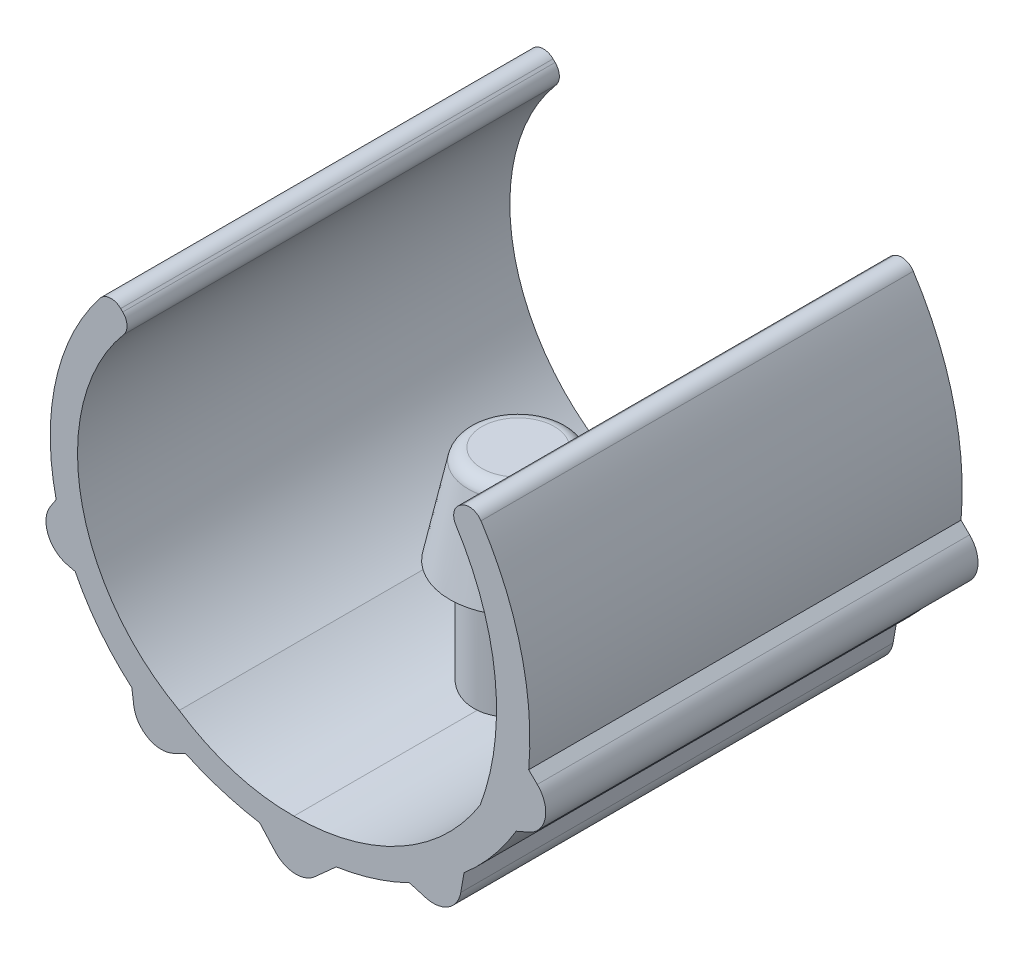
from build123d import *

# Parameters (mm, degrees)
BOSS_EXTRUDE2_DEPTH      = 438
SCALE2_SCALE             = 0.0354
FILLET1_R                = 1
FILLET3_R                = 0.5
BOSS_EXTRUDE4_REACH      = 229.494
BOSS_EXTRUDE4_END_RADIUS = 7.833804904
BOSS_EXTRUDE5_REACH      = 229.494
BOSS_EXTRUDE5_END_RADIUS = 7.195916772
SKETCH9_R                = 2.45
BOSS_EXTRUDE6_DEPTH      = 3.5
BOSS_EXTRUDE6_TAPER      = 12
FILLET4_R                = 0.5


with BuildPart() as part:
    # Sketch1 → Boss-Extrude2 (new body)
    with BuildSketch(Plane.XY):
        with BuildLine():
            Line((-163.578194132, 204.291420663), (-186.376739015, 226.341062883))
            ThreePointArc((-186.376739015, 226.341062883), (-239.375206738, 127.519864833), (-240.870528276, 15.393905402))
            Line((-240.870528276, 15.393905402), (-268.785604462, -26.370002184))
            Line((-268.785604462, -26.370002184), (-221.583341967, -38.017313709))
            ThreePointArc((-221.583341967, -38.017313709), (-196.547148618, -77.434601057), (-164.251041881, -111.161370973))
            Line((-164.251041881, -111.161370973), (-156.910200465, -164.920829998))
            Line((-156.910200465, -164.920829998), (-109.836943046, -141.764303292))
            ThreePointArc((-109.836943046, -141.764303292), (-73.054639313, -155.90344513), (-34.693982777, -164.920829998))
            Line((-34.693982777, -164.920829998), (0, -203.328769621))
            Line((0, -203.328769621), (42.8865283, -164.920829998))
            ThreePointArc((42.8865283, -164.920829998), (80.850316946, -156.155814803), (117.057486625, -141.764303292))
            Line((117.057486625, -141.764303292), (163.626630073, -155.521102036))
            Line((163.626630073, -155.521102036), (172.334894528, -105.315261233))
            ThreePointArc((172.334894528, -105.315261233), (201.269995869, -76.001800701), (225.162074479, -42.450531906))
            Line((225.162074479, -42.450531906), (276.709162079, -20.095520822))
            Line((276.709162079, -20.095520822), (237.860130884, 17.793666683))
            ThreePointArc((237.860130884, 17.793666683), (228.121311005, 125.922470041), (181.39622554, 223.91965937))
            Line((181.39622554, 223.91965937), (156.421805868, 206.970503899))
            ThreePointArc((156.421805868, 206.970503899), (202.986661671, 88.666279899), (188.748912803, -37.672398736))
            ThreePointArc((188.748912803, -37.672398736), (107.904666904, -114.25255983), (0, -141.764303292))
            ThreePointArc((0, -141.764303292), (-60.71851518, -133.27976481), (-116.145688788, -107.077591147))
            ThreePointArc((-116.145688788, -107.077591147), (-216.983443781, 36.858584217), (-163.578194132, 204.291420663))
        make_face()
    extrude(amount=BOSS_EXTRUDE2_DEPTH)


with BuildPart() as part_1:
    # Scale2: scaled about (7.22089485, -18.85403102, 219)
    add(part.part.scale(SCALE2_SCALE).moved(Location((6.965275172, -18.186598322, 211.2474))))

    # Fillet1
    fillet1_edges = [part_1.edges().sort_by_distance(p)[0] for p in [
        (16.76077951, -18.897979759, 219),
        (12.757657877, -23.692045334, 219),
        (6.965275172, -25.384436766, 219),
        (1.410654076, -24.024795704, 219),
        (-2.549735226, -19.120096399, 219),
    ]]
    fillet(fillet1_edges, radius=FILLET1_R)

    # Fillet3
    fillet3_edges = [part_1.edges().sort_by_distance(p)[0] for p in [
        (12.5026071, -10.859842484, 219),
        (13.386701556, -10.25984238, 219),
        (0.367538611, -10.174124696, 219),
        (1.1746071, -10.95468203, 219),
    ]]
    fillet(fillet3_edges, radius=FILLET3_R)

    # Boss-Extrude4: up to this cylinder (the profile starts inside it)
    boss_extrude4_end = Plane(origin=(7.002032477, -15.371335991, 218.5826), z_dir=(0, 0, -1)) * Cylinder(BOSS_EXTRUDE4_END_RADIUS, 475.655609807, mode=Mode.PRIVATE)
    # Sketch5 → Boss-Extrude4 (add, up to the surface)
    with BuildSketch(Plane(origin=(0, -19.405054659, 0), x_dir=(-1, 0, 0), z_dir=(0, -1, 0)), mode=Mode.PRIVATE) as boss_extrude4_sk1:
        with BuildLine():
            Line((-6.838033993, -220.1826), (-6.838033993, -216.9826))
            ThreePointArc((-6.838033993, -216.9826), (-8.438033993, -218.5826), (-6.838033993, -220.1826))
        make_face()
    boss_extrude4_tool1 = extrude(boss_extrude4_sk1.sketch, amount=BOSS_EXTRUDE4_REACH, mode=Mode.PRIVATE) & boss_extrude4_end
    add(boss_extrude4_tool1.solids().sort_by_distance((7.517095, -19.405055, 218.5826))[0])

    # Boss-Extrude5: up to this cylinder (the profile starts inside it)
    boss_extrude5_end = Plane(origin=(6.875019163, -16.009703934, 218.5826), z_dir=(0, 0, -1)) * Cylinder(BOSS_EXTRUDE5_END_RADIUS, 474.379833545, mode=Mode.PRIVATE)
    # Sketch8 → Boss-Extrude5 (add, up to the surface)
    with BuildSketch(Plane(origin=(0, -19.405054659, 0), x_dir=(-1, 0, 0), z_dir=(0, -1, 0)), mode=Mode.PRIVATE) as boss_extrude5_sk1:
        with BuildLine():
            Line((-6.838033993, -216.9826), (-6.838033993, -220.1826))
            ThreePointArc((-6.838033993, -220.1826), (-5.238033993, -218.5826), (-6.838033993, -216.9826))
        make_face()
    boss_extrude5_tool1 = extrude(boss_extrude5_sk1.sketch, amount=BOSS_EXTRUDE5_REACH, mode=Mode.PRIVATE) & boss_extrude5_end
    add(boss_extrude5_tool1.solids().sort_by_distance((6.158973, -19.405055, 218.5826))[0])

    # Sketch9 → Boss-Extrude6 (add)
    with BuildSketch(Plane(origin=(0, -19.405054659, 0), x_dir=(1, 0, 0), z_dir=(0, 1, 0))):
        with Locations((6.838033993, -218.5826)):
            Circle(SKETCH9_R)
    extrude(amount=BOSS_EXTRUDE6_DEPTH, taper=BOSS_EXTRUDE6_TAPER)

    # Fillet4
    fillet4_edges = [part_1.edges().sort_by_distance(p)[0] for p in [
        (5.131981959, -15.905054659, 218.5826),
    ]]
    fillet(fillet4_edges, radius=FILLET4_R)


solid = part_1.part
